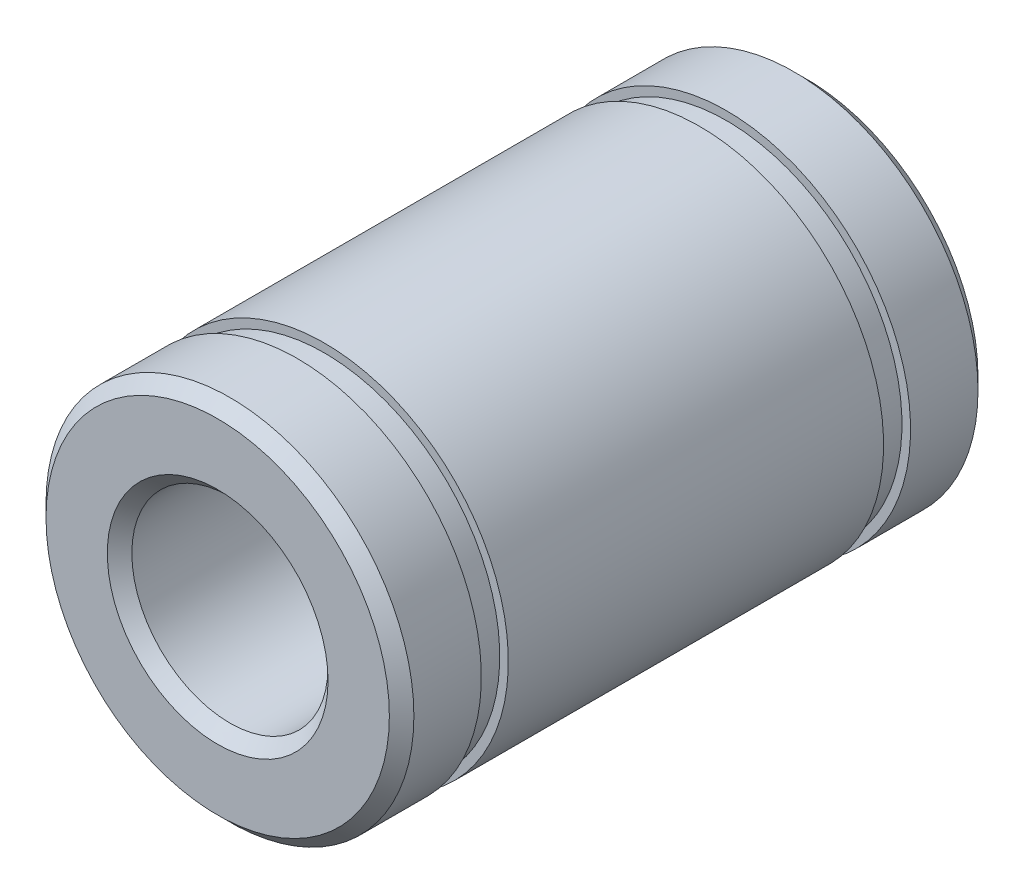
from build123d import *

# Parameters (mm, degrees)
SKETCH_1_R      = 7.5
SKETCH_1_R_2    = 4
EXTRUDE_1_DEPTH = 24
CHAMFER_1_SIZE  = 0.5
SKETCH_2_W      = 0.35
SKETCH_2_H      = 1.1


with BuildPart() as part:
    # 草图1 → 凸台-拉伸1 (new body)
    with BuildSketch(Plane.XY):
        Circle(SKETCH_1_R)
        Circle(SKETCH_1_R_2, mode=Mode.SUBTRACT)
    extrude(amount=EXTRUDE_1_DEPTH)

    # 倒角1
    chamfer_1_edges = [part.edges().sort_by_distance(p)[0] for p in [
        (-7.5, 0, 0),
        (-7.5, 0, 24),
        (-4, 0, 0),
        (-4, 0, 24),
    ]]
    chamfer(chamfer_1_edges, length=CHAMFER_1_SIZE)

    # 草图2 → 切除-旋转1 (revolve, cut)
    with BuildSketch(Plane(origin=(0, 0, 0), x_dir=(1, 0, 0), z_dir=(0, 1, 0)), mode=Mode.PRIVATE) as cut_revolve_1_sk:
        with Locations((7.325, -3.8)):
            Rectangle(SKETCH_2_W, SKETCH_2_H)
        with Locations((7.325, -20.2)):
            Rectangle(SKETCH_2_W, SKETCH_2_H)
    revolve(cut_revolve_1_sk.sketch.rotate(Axis((0, 0, 0), (0, 0, 1)), 180), axis=Axis((0, 0, 0), (0, 0, 1)), mode=Mode.SUBTRACT)


solid = part.part
